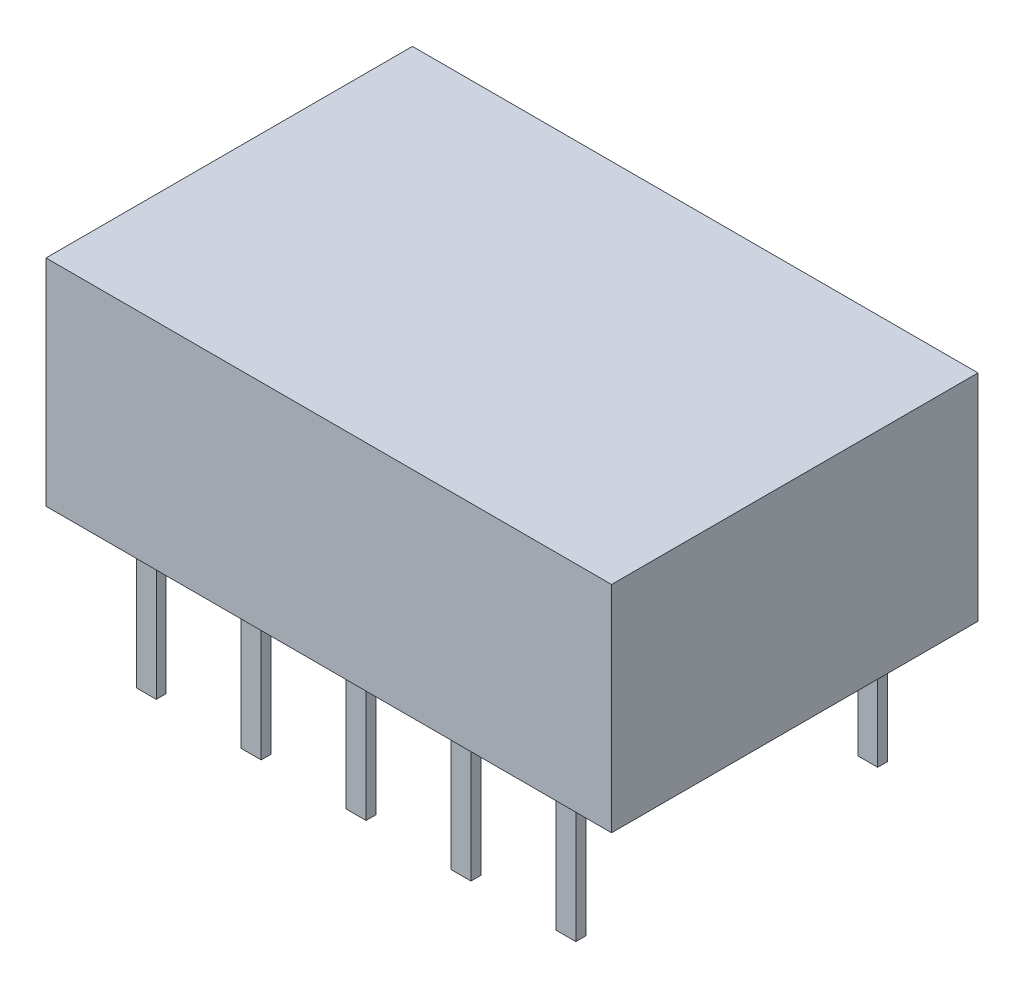
from build123d import *

# Parameters (mm, degrees)
SKETCH1_W           = 14.2
SKETCH1_H           = 5.4
BOSS_EXTRUDE1_DEPTH = 9.2
SKETCH2_W           = 0.5
SKETCH2_H           = 0.25
BOSS_EXTRUDE2_DEPTH = 3.5


with BuildPart() as part:
    # Sketch1 → Boss-Extrude1 (new body)
    with BuildSketch(Plane.XY):
        with Locations((7.1, 2.7)):
            Rectangle(SKETCH1_W, SKETCH1_H)
    extrude(amount=BOSS_EXTRUDE1_DEPTH)

    # Sketch2 → Boss-Extrude2 (add)
    with BuildSketch(Plane.XZ):
        with Locations((1.832645657, 8.389413507)):
            Rectangle(SKETCH2_W, SKETCH2_H)
        with Locations((4.466322828, 8.389413507)):
            Rectangle(SKETCH2_W, SKETCH2_H)
        with Locations((7.1, 8.389413507)):
            Rectangle(SKETCH2_W, SKETCH2_H)
        with Locations((9.733677172, 8.389413507)):
            Rectangle(SKETCH2_W, SKETCH2_H)
        with Locations((12.367354343, 8.389413507)):
            Rectangle(SKETCH2_W, SKETCH2_H)
        with Locations((4.466322828, 0.810586493)):
            Rectangle(SKETCH2_W, SKETCH2_H)
        with Locations((7.1, 0.810586493)):
            Rectangle(SKETCH2_W, SKETCH2_H)
        with Locations((9.733677172, 0.810586493)):
            Rectangle(SKETCH2_W, SKETCH2_H)
        with Locations((12.367354343, 0.810586493)):
            Rectangle(SKETCH2_W, SKETCH2_H)
        with Locations((1.832645657, 0.810586493)):
            Rectangle(SKETCH2_W, SKETCH2_H)
    extrude(amount=BOSS_EXTRUDE2_DEPTH)


solid = part.part
